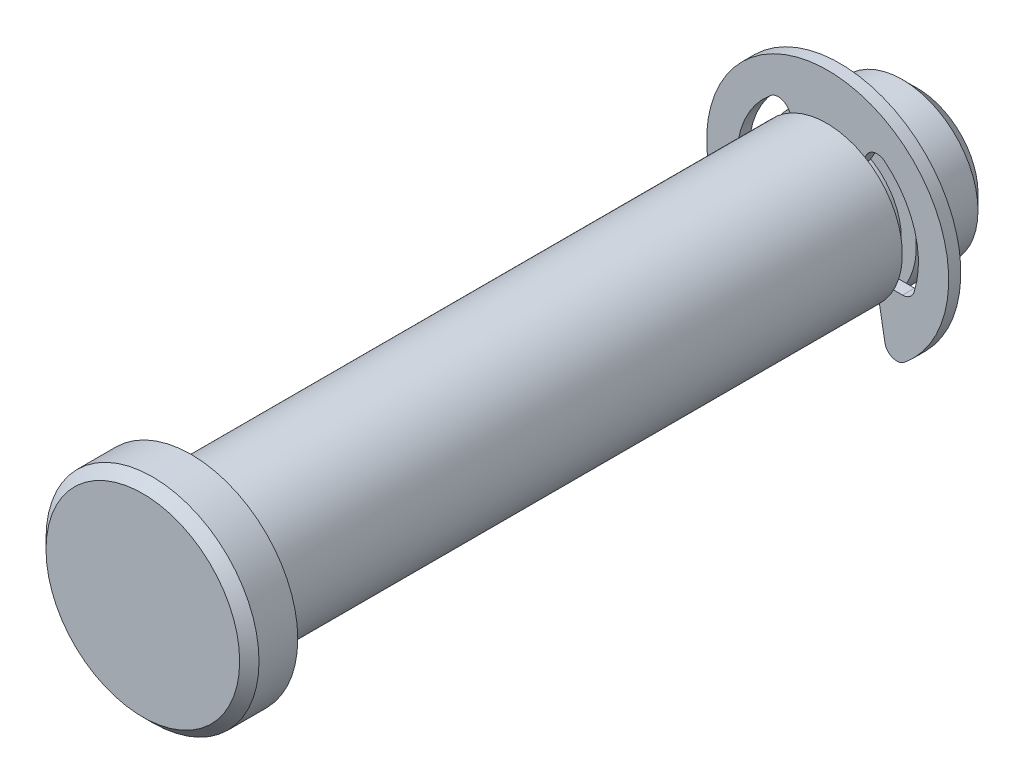
from build123d import *

# Parameters (mm, degrees)
SKETCH2_R      = 3.96875
EXTRUDE1_DEPTH = 19.05
SKETCH3_W      = 0.7366
SKETCH3_H      = 0.79375
SKETCH8_R      = 5.588
EXTRUDE6_DEPTH = 2.54
CHAMFER2_SIZE  = 0.508
SKETCH4_R      = 6.35
SKETCH4_R_2    = 3.175
EXTRUDE2_DEPTH = 0.3175
EXTRUDE4_DEPTH = 24.383179852
EXTRUDE5_DEPTH = 0.635
FILLET1_R      = 0.635
CHAMFER1_SIZE  = 0.79375


with BuildPart() as part:
    # Sketch2 → Extrude1 (new, symmetric)
    with BuildSketch(Plane.XY):
        with Locations(Location((0, 0, 0), (0, 0, 180))):
            Circle(SKETCH2_R)
    extrude(amount=EXTRUDE1_DEPTH, both=True)

    # Sketch3 → Cut-Revolve1 (revolve, cut)
    with BuildSketch(Plane(origin=(0, 0, 0), x_dir=(0, 0, -1), z_dir=(1, 0, 0)), mode=Mode.PRIVATE) as cut_revolve1_sk:
        with Locations((14.6558, 3.571875)):
            Rectangle(SKETCH3_W, SKETCH3_H)
    revolve(cut_revolve1_sk.sketch.rotate(Axis((0, 0, 19.05), (0, 0, -1)), 270), axis=Axis((0, 0, 19.05), (0, 0, -1)), mode=Mode.SUBTRACT)

    # Sketch8 → Extrude6 (add)
    with BuildSketch(Plane.XY.offset(19.05)):
        Circle(SKETCH8_R)
    extrude(amount=EXTRUDE6_DEPTH)

    # Chamfer2
    chamfer2_edges = [part.edges().sort_by_distance(p)[0] for p in [
        (-5.588, 0, 21.59),
    ]]
    chamfer(chamfer2_edges, length=CHAMFER2_SIZE)

    # Chamfer1
    chamfer1_edges = [part.edges().sort_by_distance(p)[0] for p in [
        (3.96875, 0, -19.05),
    ]]
    chamfer(chamfer1_edges, length=CHAMFER1_SIZE)


with BuildPart() as body_2:
    # Sketch4 → Extrude2 (new, symmetric)
    with BuildSketch(Plane.XY.offset(-14.6558)):
        Circle(SKETCH4_R)
        Circle(SKETCH4_R_2, mode=Mode.SUBTRACT)
    extrude(amount=EXTRUDE2_DEPTH, both=True)

    # Sketch5 → Extrude4 (cut, through all)
    with BuildSketch(Plane.XY):
        with BuildLine():
            Line((-2.38125, 4.124445986), (0, 0))
            Line((0, 0), (2.38125, 4.124445986))
            ThreePointArc((2.38125, 4.124445986), (4.523958552, 1.488356568), (4.364903349, -1.905))
            Line((4.364903349, -1.905), (2.54, -1.905))
            Line((2.54, -1.905), (3.173879308, -5.499908194))
            ThreePointArc((3.173879308, -5.499908194), (0, -6.35), (-3.173879308, -5.499908194))
            Line((-3.173879308, -5.499908194), (-2.54, -1.905))
            Line((-2.54, -1.905), (-4.364903349, -1.905))
            ThreePointArc((-4.364903349, -1.905), (-4.523958552, 1.488356568), (-2.38125, 4.124445986))
        make_face()
    extrude(amount=-EXTRUDE4_DEPTH, mode=Mode.SUBTRACT)

    # Sketch6 → Extrude5 (add)
    with BuildSketch(Plane.XY.offset(-14.3383)):
        with BuildLine():
            Line((-1.5875, 2.749630657), (1.5875, 2.749630657))
            ThreePointArc((1.5875, 2.749630657), (0, 3.175), (-1.5875, 2.749630657))
        make_face()
    extrude(amount=-EXTRUDE5_DEPTH)

    # Fillet1
    fillet1_edges = [body_2.edges().sort_by_distance(p)[0] for p in [
        (2.38125, 4.124445986, -14.6558),
        (3.173879308, -5.499908194, -14.6558),
        (-4.364903349, -1.905, -14.6558),
        (4.364903349, -1.905, -14.6558),
        (-3.173879308, -5.499908194, -14.6558),
        (-2.38125, 4.124445986, -14.6558),
    ]]
    fillet(fillet1_edges, radius=FILLET1_R)


solid = Compound([part.part, body_2.part])
